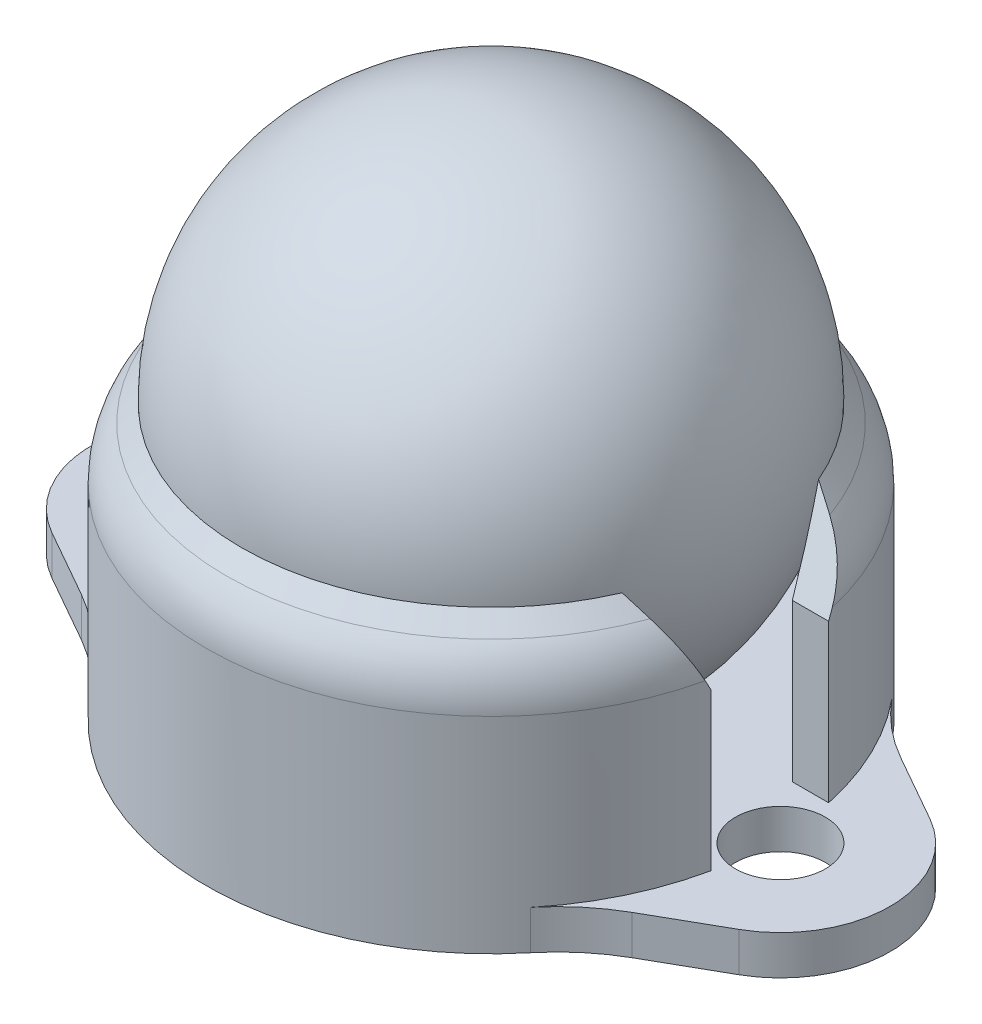
from build123d import *
from build123d.topology import SkipClean

# Parameters (mm, degrees)
SKICA1_R                      = 1.143
P_IDAT_VYSUNUT_M1_DEPTH       = 1
ODEBRAT_VYSUNUT_M1_DEPTH      = 19.357928681
ODEBRAT_VYSUNUT_M1_DEPTH_BACK = 19.357928681


with BuildPart() as part:
    # Skica1 → Přidat vysunutím1 (new body)
    with BuildSketch(Plane(origin=(0, 0, 0), x_dir=(1, 0, 0), z_dir=(0, 1, 0))):
        with BuildLine():
            Line((-8.745264485, 2.429828282), (-7.005945743, 3.417132853))
            ThreePointArc((-7.005945743, 3.417132853), (-6.252202895, 3.941990357), (-5.607183834, 4.595866561))
            ThreePointArc((-5.607183834, 4.595866561), (0, 7.25), (5.607183834, 4.595866561))
            ThreePointArc((5.607183834, 4.595866561), (6.252202895, 3.941990357), (7.005945743, 3.417132853))
            Line((7.005945743, 3.417132853), (8.745264485, 2.429828282))
            ThreePointArc((8.745264485, 2.429828282), (10.16, 0), (8.745264485, -2.429828282))
            Line((8.745264485, -2.429828282), (7.005945743, -3.417132853))
            ThreePointArc((7.005945743, -3.417132853), (6.252202895, -3.941990357), (5.607183834, -4.595866561))
            ThreePointArc((5.607183834, -4.595866561), (0, -7.25), (-5.607183834, -4.595866561))
            ThreePointArc((-5.607183834, -4.595866561), (-6.252202895, -3.941990357), (-7.005945743, -3.417132853))
            Line((-7.005945743, -3.417132853), (-8.745264485, -2.429828282))
            ThreePointArc((-8.745264485, -2.429828282), (-10.16, 0), (-8.745264485, 2.429828282))
        make_face()
        with Locations(Location((-7.366, 0, 0), (0, 0, 270))):
            Circle(SKICA1_R, mode=Mode.SUBTRACT)
        with Locations(Location((7.366, 0, 0), (0, 0, 90))):
            Circle(SKICA1_R, mode=Mode.SUBTRACT)
    extrude(amount=P_IDAT_VYSUNUT_M1_DEPTH)

    # Skica3 → Rotovat5 (revolve)
    with SkipClean():  # the faces are left unmerged after this step: merging them gives an invalid solid
        with BuildSketch(Plane(origin=(0, 0, 0), x_dir=(0, 0, -1), z_dir=(1, 0, 0))):
            with BuildLine():
                Line((7.25, 1), (7.25, 5.231902127))
                ThreePointArc((7.25, 5.231902127), (7.11704533, 5.9489389), (6.735858265, 6.570642287))
                Line((6.735858265, 6.570642287), (6.349012207, 7))
                Line((6.349012207, 7), (6.349012207, 1))
                Line((6.349012207, 1), (7.25, 1))
            make_face()
        revolve(axis=Axis((0, 0, 0), (0, 1, 0)))

    # Skica4 → Odebrat vysunutím1 (cut, two sides: drawn at the far end of the back side and taken through both)
    with SkipClean():  # the faces are left unmerged after this step: merging them gives an invalid solid
        with BuildSketch(Plane(origin=(0, 0, 0), x_dir=(0, 0, -1), z_dir=(1, 0, 0)).offset(-ODEBRAT_VYSUNUT_M1_DEPTH_BACK)):
            Polygon((-2.5, 7), (-1.5, 5), (-1.5, 1), (1.5, 1), (1.5, 5), (2.5, 7), align=None)
        extrude(amount=ODEBRAT_VYSUNUT_M1_DEPTH + ODEBRAT_VYSUNUT_M1_DEPTH_BACK, mode=Mode.SUBTRACT)


with BuildPart() as body_2:
    # Skica2 → Rotovat2 (revolve)
    with BuildSketch(Plane.XY):
        with BuildLine():
            Line((0, 13.462), (0, 0.762))
            ThreePointArc((0, 0.762), (6.35, 7.112), (0, 13.462))
        make_face()
    revolve(axis=Axis((0, 0, 0), (0, 1, 0)))


solid = Compound([part.part, body_2.part])
